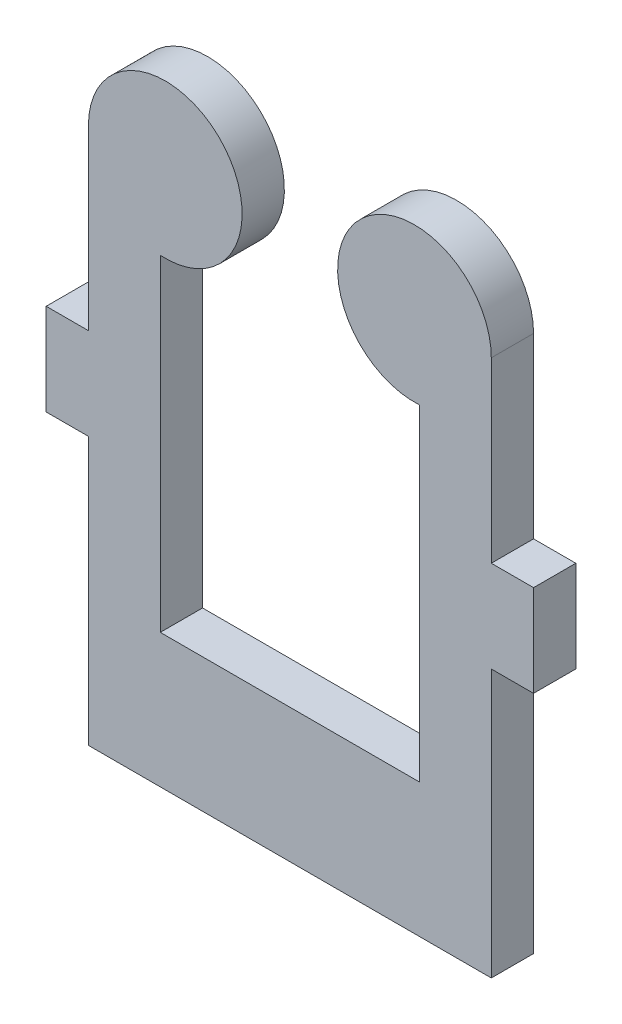
from build123d import *

# Parameters (mm, degrees)
BASE_START = 3
BASE_DEPTH = 3


with BuildPart() as part:
    # Sketch5 → Base (new body)
    with BuildSketch(Plane.XY.offset(9.55).offset(BASE_START)):
        with BuildLine():
            Line((9.2, 4.5), (-9.2, 4.5))
            Line((-9.2, 4.5), (-9.2, 27.686563585))
            ThreePointArc((-9.2, 27.686563585), (-4.864199201, 36.859644755), (-14.3, 33.13))
            Line((-14.3, 33.13), (-14.3, 20.5))
            Line((-14.3, 20.5), (-17.3, 20.5))
            Line((-17.3, 20.5), (-17.3, 14))
            Line((-17.3, 14), (-14.3, 14))
            Line((-14.3, 14), (-14.3, -5))
            Line((-14.3, -5), (14.3, -5))
            Line((14.3, -5), (14.3, 14))
            Line((14.3, 14), (17.3, 14))
            Line((17.3, 14), (17.3, 20.5))
            Line((17.3, 20.5), (14.3, 20.5))
            Line((14.3, 20.5), (14.3, 33.13))
            ThreePointArc((14.3, 33.13), (4.864199201, 36.859644755), (9.2, 27.686563585))
            Line((9.2, 27.686563585), (9.2, 4.5))
        make_face()
    extrude(amount=BASE_DEPTH)


solid = part.part
